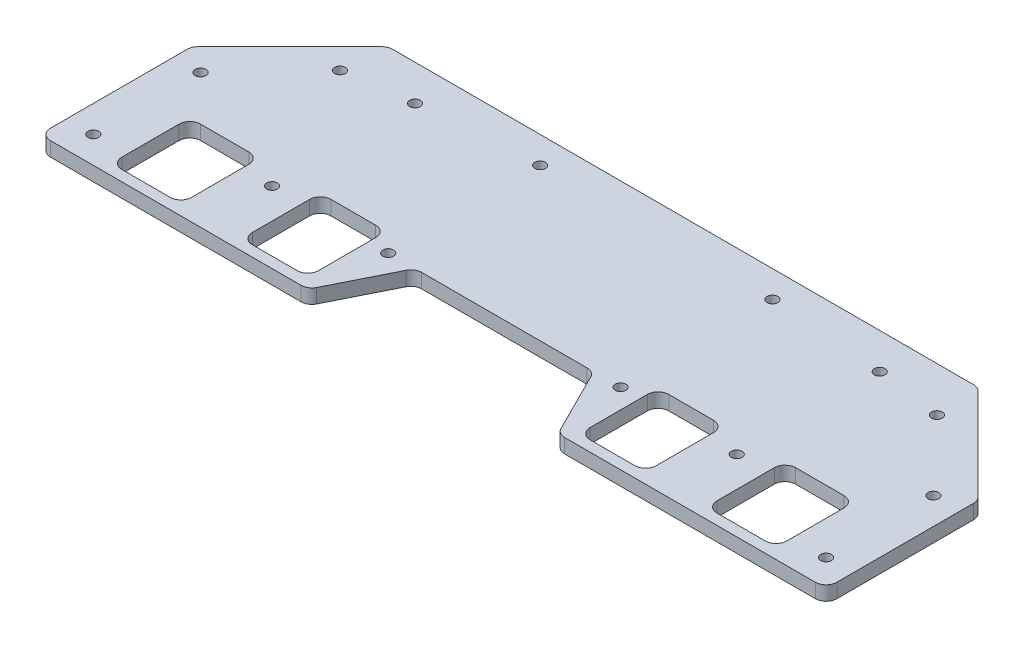
from build123d import *

# Parameters (mm, degrees)
EXTRUDE_1_DEPTH     = 4
SKETCH_2_R          = 1.5
CUT_EXTRUDE_1_DEPTH = 4
SKETCH_3_W          = 10
SKETCH_3_H          = 69.678883607
SKETCH_3_H_2        = 93.047687854
CUT_EXTRUDE_2_DEPTH = 4
CUT_EXTRUDE_3_DEPTH = 4
EXTRUDE_2_DEPTH     = 4
SKETCH_6_R          = 1.5
CUT_EXTRUDE_4_DEPTH = 10
SKETCH_7_W          = 19.5
SKETCH_7_H          = 22
SKETCH_7_W_2        = 18.5
CUT_EXTRUDE_5_DEPTH = 10
FILLET_1_R          = 3
FILLET_2_R          = 3
FILLET_3_R          = 3
SKETCH_8_R          = 1.5
CUT_EXTRUDE_6_DEPTH = 10


with BuildPart() as part:
    # 草图1 → 凸台-拉伸1 (new body)
    with BuildSketch(Plane(origin=(0, 0, 0), x_dir=(1, 0, 0), z_dir=(0, 1, 0))):
        Polygon((-137.5, -35), (-67.5, -35), (-57.5, -35), (-47.5, -15), (2.5, -15), (12.5, -35), (22.5, -35), (92.5, -35), (92.5, 15), (72.5, 35), (-117.5, 35), (-137.5, 15), align=None)
    extrude(amount=EXTRUDE_1_DEPTH)

    # 草图2 → 切除-拉伸1 (cut)
    with BuildSketch(Plane(origin=(0, 4, 0), x_dir=(1, 0, 0), z_dir=(0, 1, 0))):
        with Locations(Location((-87.5, -15, 0), (0, 0, 270))):
            Circle(SKETCH_2_R)
        with Locations(Location((-87.5, 25, 0), (0, 0, 270))):
            Circle(SKETCH_2_R)
        with Locations(Location((42.5, 25, 0), (0, 0, 90))):
            Circle(SKETCH_2_R)
        with Locations(Location((42.5, -15, 0), (0, 0, 90))):
            Circle(SKETCH_2_R)
    extrude(amount=-CUT_EXTRUDE_1_DEPTH, mode=Mode.SUBTRACT)

    # 草图3 → 切除-拉伸2 (cut)
    with BuildSketch(Plane(origin=(0, 4, 0), x_dir=(1, 0, 0), z_dir=(0, 1, 0))):
        with Locations((-132.5, -0.160558196)):
            Rectangle(SKETCH_3_W, SKETCH_3_H)
        with Locations((87.5, 11.523843927)):
            Rectangle(SKETCH_3_W, SKETCH_3_H_2)
    extrude(amount=-CUT_EXTRUDE_2_DEPTH, mode=Mode.SUBTRACT)

    # 草图4 → 切除-拉伸3 (cut)
    with BuildSketch(Plane(origin=(0, 4, 0), x_dir=(1, 0, 0), z_dir=(0, 1, 0))):
        Polygon((-127.5, 12.5), (-92.197077218, 47.802922782), (-150.178982695, 47.802922782), align=None)
        Polygon((82.5, 12.5), (37.005283765, 57.994716235), (96.544114713, 56.205234398), align=None)
    extrude(amount=-CUT_EXTRUDE_3_DEPTH, mode=Mode.SUBTRACT)

    # 草图5 → 凸台-拉伸2 (add)
    with BuildSketch(Plane(origin=(0, 4, 0), x_dir=(1, 0, 0), z_dir=(0, 1, 0))):
        Polygon((-127.5, 12.5), (-132.5, 7.5), (-132.5, -35), (-127.5, -35), align=None)
        Polygon((82.5, -35), (82.5, 12.5), (87.5, 7.5), (87.5, -35), align=None)
    extrude(amount=-EXTRUDE_2_DEPTH)

    # 草图6 → 切除-拉伸4 (cut)
    with BuildSketch(Plane(origin=(0, 4, 0), x_dir=(1, 0, 0), z_dir=(0, 1, 0))):
        with Locations(Location((59.5, -29, 0), (0, 0, 270))):
            Circle(SKETCH_6_R)
        with Locations(Location((59.5, -19, 0), (0, 0, 270))):
            Circle(SKETCH_6_R)
        with Locations(Location((23.5, -19, 0), (0, 0, 270))):
            Circle(SKETCH_6_R)
        with Locations(Location((23.5, -29, 0), (0, 0, 270))):
            Circle(SKETCH_6_R)
        with Locations(Location((-68.5, -29, 0), (0, 0, 90))):
            Circle(SKETCH_6_R)
        with Locations(Location((-68.5, -19, 0), (0, 0, 90))):
            Circle(SKETCH_6_R)
        with Locations(Location((-104.5, -19, 0), (0, 0, 90))):
            Circle(SKETCH_6_R)
        with Locations(Location((-104.5, -29, 0), (0, 0, 90))):
            Circle(SKETCH_6_R)
    extrude(amount=-CUT_EXTRUDE_4_DEPTH, mode=Mode.SUBTRACT)

    # 草图7 → 切除-拉伸5 (cut)
    with BuildSketch(Plane(origin=(0, 4, 0), x_dir=(1, 0, 0), z_dir=(0, 1, 0))):
        with Locations((-105.75, -21)):
            Rectangle(SKETCH_7_W, SKETCH_7_H)
        with Locations((-69.75, -21)):
            Rectangle(SKETCH_7_W_2, SKETCH_7_H)
        with Locations((24.75, -21)):
            Rectangle(SKETCH_7_W_2, SKETCH_7_H)
        with Locations((60.75, -21)):
            Rectangle(SKETCH_7_W, SKETCH_7_H)
    extrude(amount=-CUT_EXTRUDE_5_DEPTH, mode=Mode.SUBTRACT)

    # 圆角1
    fillet_1_edges = [part.edges().sort_by_distance(p)[0] for p in [
        (-115.5, 2, 32),
        (-115.5, 2, 10),
        (-96, 2, 10),
        (-96, 2, 32),
        (-79, 2, 32),
        (-79, 2, 10),
        (-60.5, 2, 10),
        (-60.5, 2, 32),
    ]]
    fillet(fillet_1_edges, radius=FILLET_1_R)

    # 圆角2
    fillet_2_edges = [part.edges().sort_by_distance(p)[0] for p in [
        (15.5, 2, 10),
        (34, 2, 10),
        (34, 2, 32),
        (15.5, 2, 32),
        (51, 2, 10),
        (70.5, 2, 10),
        (70.5, 2, 32),
        (51, 2, 32),
    ]]
    fillet(fillet_2_edges, radius=FILLET_2_R)

    # 圆角3
    fillet_3_edges = [part.edges().sort_by_distance(p)[0] for p in [
        (60, 2, -35),
        (-132.5, 2, -7.5),
        (-132.5, 2, 35),
        (87.5, 2, -7.5),
        (87.5, 2, 35),
        (12.5, 2, 35),
        (2.5, 2, 15),
        (-47.5, 2, 15),
        (-57.5, 2, 35),
        (-105, 2, -35),
    ]]
    fillet(fillet_3_edges, radius=FILLET_3_R)

    # 草图8 → 切除-拉伸6 (cut)
    with BuildSketch(Plane.XZ):
        with Locations(Location((-125, 27.5, 0), (0, 0, 270))):
            Circle(SKETCH_8_R)
        with Locations(Location((-125, -2.5, 0), (0, 0, 270))):
            Circle(SKETCH_8_R)
        with Locations(Location((-55, 15, 0), (0, 0, 270))):
            Circle(SKETCH_8_R)
        with Locations(Location((-55, -27.5, 0), (0, 0, 270))):
            Circle(SKETCH_8_R)
        with Locations(Location((10, -27.5, 0), (0, 0, 270))):
            Circle(SKETCH_8_R)
        with Locations(Location((10, 15, 0), (0, 0, 270))):
            Circle(SKETCH_8_R)
        with Locations(Location((80, -2.5, 0), (0, 0, 270))):
            Circle(SKETCH_8_R)
        with Locations(Location((80, 27.5, 0), (0, 0, 270))):
            Circle(SKETCH_8_R)
        with Locations(Location((-106, -22.5, 0), (0, 0, 270))):
            Circle(SKETCH_8_R)
        with Locations(Location((61, -22.5, 0), (0, 0, 270))):
            Circle(SKETCH_8_R)
    extrude(amount=-CUT_EXTRUDE_6_DEPTH, mode=Mode.SUBTRACT)


solid = part.part
